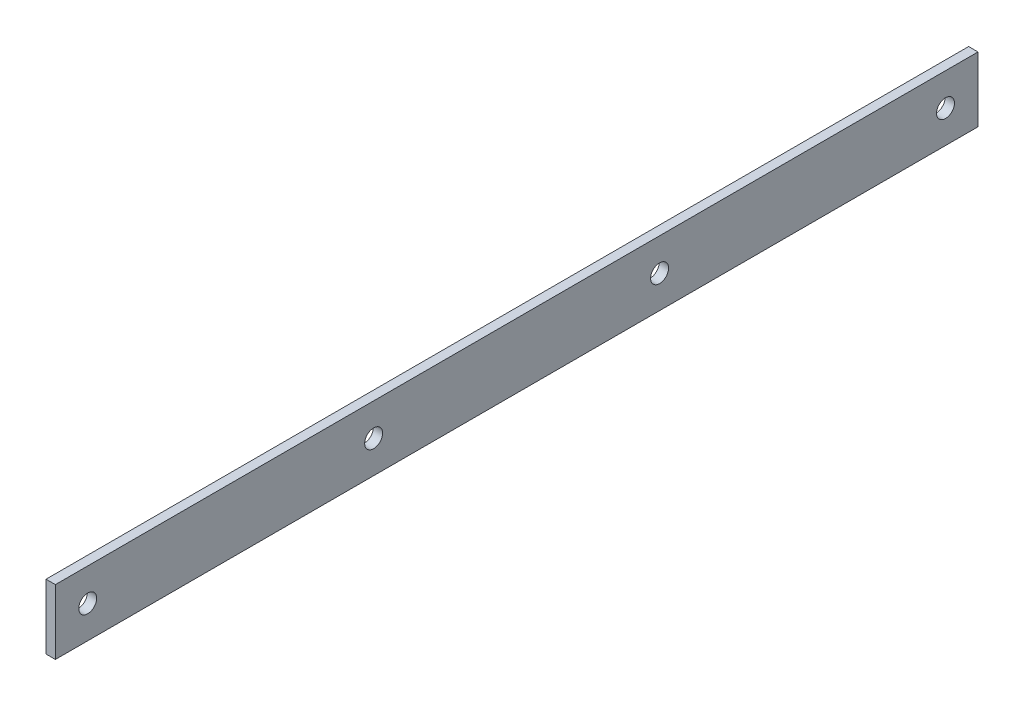
from build123d import *

# Parameters (mm, degrees)
SKETCH1_W           = 1181
SKETCH1_H           = 83
BOSS_EXTRUDE1_DEPTH = 12
SKETCH2_R           = 11.5
CUT_EXTRUDE1_DEPTH  = 12
LPATTERN1_COUNT     = 4
LPATTERN1_PITCH     = 366


with BuildPart() as part:
    # Sketch1 → Boss-Extrude1 (new body)
    with BuildSketch(Plane(origin=(0, 0, 0), x_dir=(0, 0, -1), z_dir=(1, 0, 0))):
        Rectangle(SKETCH1_W, SKETCH1_H)
    extrude(amount=BOSS_EXTRUDE1_DEPTH)

    # Sketch2 → Cut-Extrude1 (cut)
    with BuildSketch(Plane(origin=(12, 0, 0), x_dir=(0, 0, -1), z_dir=(1, 0, 0))):
        with Locations((-549.1, 0)):
            Circle(SKETCH2_R)
    cut_extrude1 = extrude(amount=-CUT_EXTRUDE1_DEPTH, mode=Mode.SUBTRACT)

    # LPattern1: Cut-Extrude1 ×4
    with Locations(*[(0, 0, -i * LPATTERN1_PITCH) for i in range(1, LPATTERN1_COUNT)]):
        add(cut_extrude1, mode=Mode.SUBTRACT)


solid = part.part
